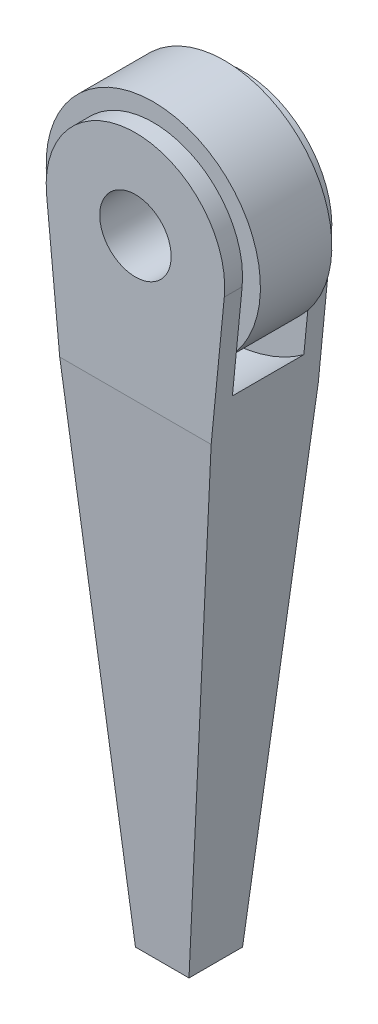
from build123d import *
from build123d.topology import SkipClean

# Parameters (mm, degrees)
SKETCH1_R               = 10
BOSS_EXTRUDE1_DEPTH     = 15
CUT_EXTRUDE1_DEPTH      = 10
SKETCH1_5_R             = 30
SKETCH1_5_R_2           = 25
BOSS_EXTRUDE2_DEPTH     = 10
CUT_EXTRUDE2_DEPTH      = 184.098334236
CUT_EXTRUDE2_DEPTH_BACK = 184.098334236


with BuildPart() as part:
    # Sketch1 → Boss-Extrude1 (new, symmetric)
    with BuildSketch(Plane.XY):
        with BuildLine():
            ThreePointArc((24.881082953, -2.435510432), (0, 25), (-24.881082953, -2.435510432))
            Line((-24.881082953, -2.435510432), (-7.5, -180))
            Line((-7.5, -180), (7.5, -180))
            Line((7.5, -180), (24.881082953, -2.435510432))
        make_face()
        Circle(SKETCH1_R, mode=Mode.SUBTRACT)
    extrude(amount=BOSS_EXTRUDE1_DEPTH, both=True)

    # Sketch1<4> → Cut-Extrude1 (cut, symmetric)
    with SkipClean():  # the faces are left unmerged after this step: merging them gives an invalid solid
        with BuildSketch(Plane.XY):
            with BuildLine():
                ThreePointArc((24.881082953, -2.435510432), (0, -25), (-24.881082953, -2.435510432))
                Line((-24.881082953, -2.435510432), (-22.15809951, -30.253406851))
                ThreePointArc((-22.15809951, -30.253406851), (0, -37.5), (22.15809951, -30.253406851))
                Line((22.15809951, -30.253406851), (24.881082953, -2.435510432))
            make_face()
        extrude(amount=CUT_EXTRUDE1_DEPTH, both=True, mode=Mode.SUBTRACT)

    # Sketch1<5> → Boss-Extrude2 (add, symmetric)
    with BuildSketch(Plane.XY):
        Circle(SKETCH1_5_R)
        Circle(SKETCH1_5_R_2, mode=Mode.SUBTRACT)
    extrude(amount=BOSS_EXTRUDE2_DEPTH, both=True)

    # Sketch3 → Cut-Extrude2 (cut, two sides: drawn at the far end of the back side and taken through both)
    with BuildSketch(Plane(origin=(0, 0, 0), x_dir=(0, 0, -1), z_dir=(1, 0, 0)).offset(-CUT_EXTRUDE2_DEPTH_BACK)):
        Polygon((-15, -180), (-7.5, -180), (-15, -40), align=None)
        Polygon((15, -40), (7.5, -180), (15, -180), align=None)
    extrude(amount=CUT_EXTRUDE2_DEPTH + CUT_EXTRUDE2_DEPTH_BACK, mode=Mode.SUBTRACT)


solid = part.part
